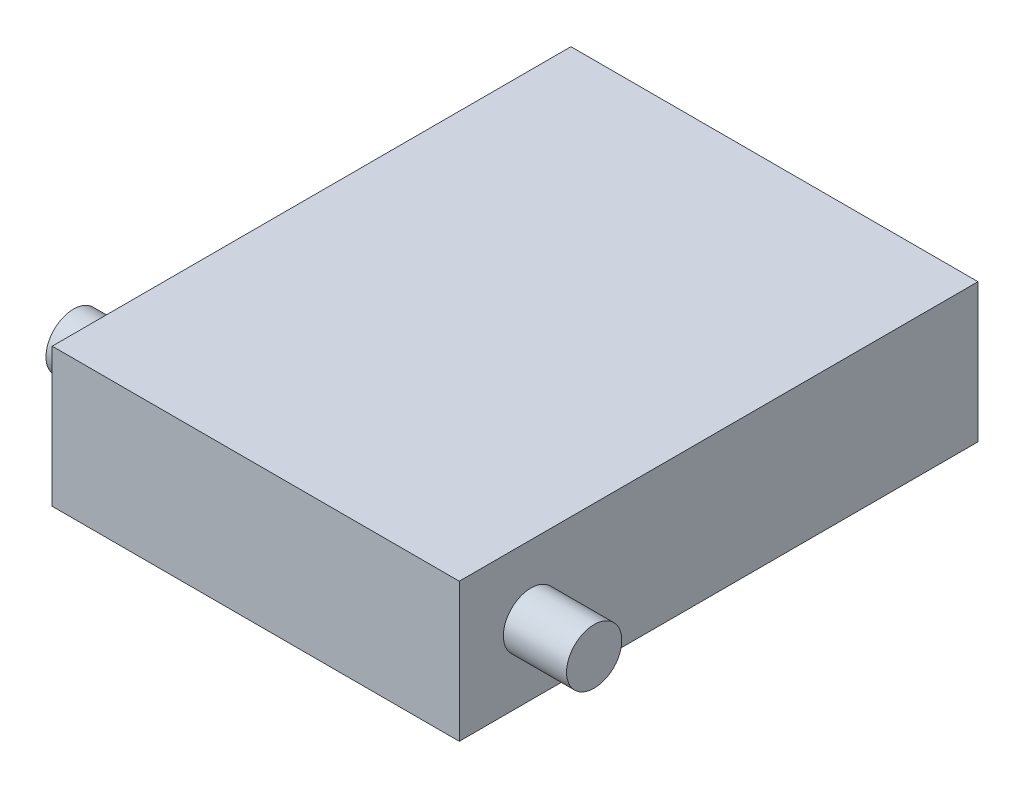
from build123d import *

# Parameters (mm, degrees)
SKETCH1_W           = 20.34
SKETCH1_H           = 25.92
BOSS_EXTRUDE2_DEPTH = 6.93
SKETCH3_R           = 1.38
BOSS_EXTRUDE3_DEPTH = 3.158
SKETCH6_R           = 1.38
BOSS_EXTRUDE4_DEPTH = 3.158


with BuildPart() as part:
    # Sketch1 → Boss-Extrude2 (new body)
    with BuildSketch(Plane(origin=(0, 0, 0), x_dir=(1, 0, 0), z_dir=(0, 1, 0))):
        with Locations((10.17, -12.96)):
            Rectangle(SKETCH1_W, SKETCH1_H)
    extrude(amount=-BOSS_EXTRUDE2_DEPTH)

    # Sketch3 → Boss-Extrude3 (add)
    with BuildSketch(Plane(origin=(20.34, 0, 0), x_dir=(0, 0, -1), z_dir=(1, 0, 0))):
        with Locations(Location((-22.336733694, -3.465, 0), (0, 0, 180))):
            Circle(SKETCH3_R)
    extrude(amount=BOSS_EXTRUDE3_DEPTH)

    # Sketch6 → Boss-Extrude4 (add)
    with BuildSketch(Plane.ZY):
        with Locations(Location((21.694091509, -3.465, 0), (0, 0, 180))):
            Circle(SKETCH6_R)
    extrude(amount=BOSS_EXTRUDE4_DEPTH)


solid = part.part
